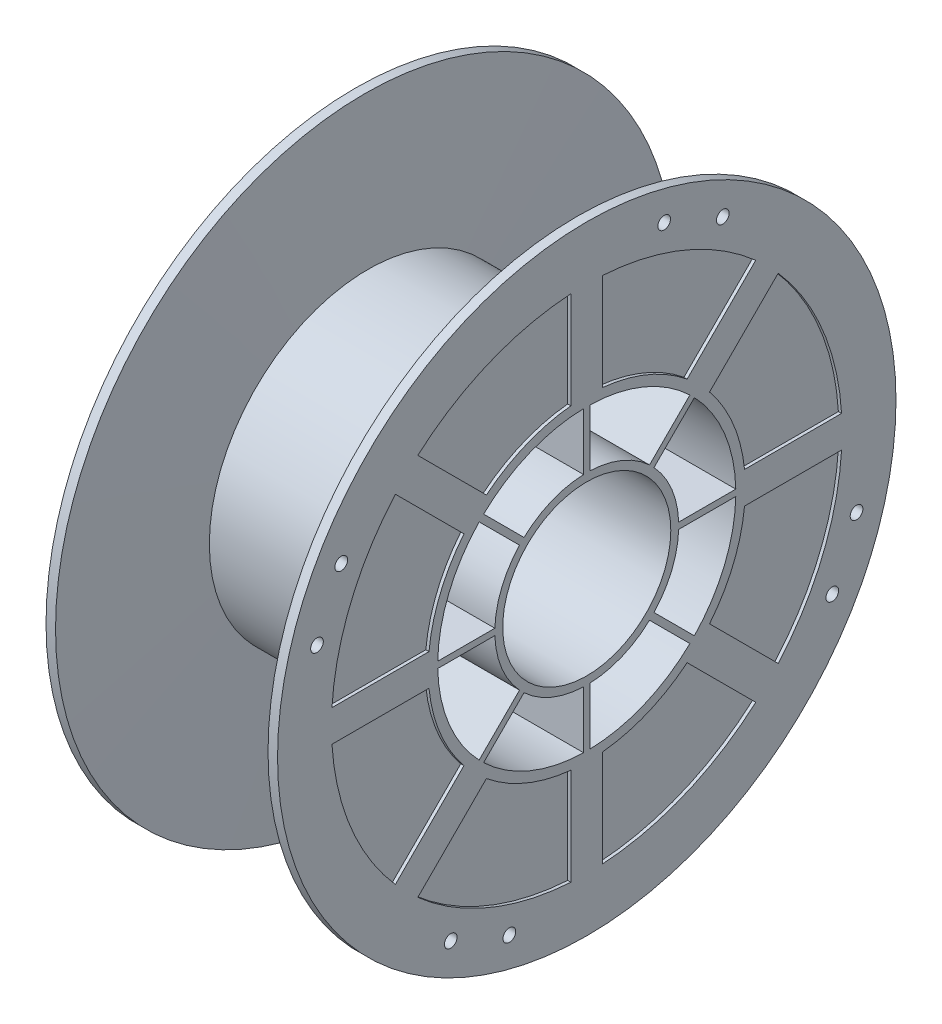
from build123d import *

# Parameters (mm, degrees)
SKETCH1_R                = 50
SKETCH1_R_2              = 26.5
BOSS_EXTRUDE1_DEPTH      = 6
BOSS_EXTRUDE2_DEPTH      = 36
BOSS_EXTRUDE2_DEPTH_BACK = 37
SKETCH2_R                = 50
SKETCH2_R_2              = 47
SKETCH2_R_3              = 29
SKETCH2_R_4              = 26.5
BOSS_EXTRUDE3_START      = -37
BOSS_EXTRUDE3_DEPTH      = 73
CIRPATTERN1_COUNT        = 8
BOSS_EXTRUDE4_START      = 1
BOSS_EXTRUDE4_DEPTH      = 1
BOSS_EXTRUDE5_DEPTH      = 1
CIRPATTERN2_COUNT        = 8
CUT_EXTRUDE1_REACH       = 158.018
SKETCH7_R                = 2
CIRPATTERN3_COUNT        = 4


with BuildPart() as part:
    # Sketch1 → Boss-Extrude1 (new body)
    with BuildSketch(Plane(origin=(0, 0, 0), x_dir=(0, 0, -1), z_dir=(1, 0, 0))):
        Circle(SKETCH1_R)
        Circle(SKETCH1_R_2, mode=Mode.SUBTRACT)
    extrude(amount=BOSS_EXTRUDE1_DEPTH)

    # Sketch2 → Boss-Extrude2 (add, two sides: drawn at the far end of the back side and taken through both)
    # profile 1 of 2: a face of its own
    with BuildSketch(Plane(origin=(0, 0, 0), x_dir=(0, 0, -1), z_dir=(1, 0, 0)).offset(-BOSS_EXTRUDE2_DEPTH_BACK)):
        Circle(SKETCH2_R)
        Circle(SKETCH2_R_2, mode=Mode.SUBTRACT)
    # profile 2 of 2: a face of its own
    with BuildSketch(Plane(origin=(0, 0, 0), x_dir=(0, 0, -1), z_dir=(1, 0, 0)).offset(-BOSS_EXTRUDE2_DEPTH_BACK)):
        Circle(SKETCH2_R_3)
        Circle(SKETCH2_R_4, mode=Mode.SUBTRACT)
    extrude(amount=BOSS_EXTRUDE2_DEPTH + BOSS_EXTRUDE2_DEPTH_BACK)

    # Sketch2<3> → Boss-Extrude3 (add)
    with BuildSketch(Plane(origin=(0, 0, 0), x_dir=(0, 0, -1), z_dir=(1, 0, 0)).offset(BOSS_EXTRUDE3_START)):
        with BuildLine():
            ThreePointArc((-1, 28.982753492), (0, 29), (1, 28.982753492))
            Line((1, 28.982753492), (1, 46.989360498))
            ThreePointArc((1, 46.989360498), (0, 47), (-1, 46.989360498))
            Line((-1, 46.989360498), (-1, 28.982753492))
        make_face()
    boss_extrude3 = extrude(amount=BOSS_EXTRUDE3_DEPTH)

    # CirPattern1: Boss-Extrude3 ×8 about axis
    cirpattern1_axis = Axis((6, 0, 0), (-1, 0, 0))
    for i in range(1, CIRPATTERN1_COUNT):
        add(boss_extrude3.rotate(cirpattern1_axis, i * 360 / CIRPATTERN1_COUNT))

    # Sketch4 → Revolve1 (revolve)
    with BuildSketch(Plane.XY):
        Polygon((36, 80.5), (36, 97.5), (33, 97.5), (32, 50), (35, 50), (35, 80.5), align=None)
        Polygon((-33, 50), (-36, 50), (-36, 67.5), (-37, 67.5), (-37, 97.5), (-34, 97.5), align=None)
    revolve(axis=Axis((0, 0, 0), (1, 0, 0)))

    # Sketch5 → Boss-Extrude4 (add)
    with BuildSketch(Plane.ZY.offset(36).offset(BOSS_EXTRUDE4_START)):
        with BuildLine():
            ThreePointArc((-5, 49.749371855), (0, 50), (5, 49.749371855))
            Line((5, 49.749371855), (5, 67.314560089))
            ThreePointArc((5, 67.314560089), (0, 67.5), (-5, 67.314560089))
            Line((-5, 67.314560089), (-5, 49.749371855))
        make_face()
    boss_extrude4 = extrude(amount=-BOSS_EXTRUDE4_DEPTH)

    # Sketch6 → Boss-Extrude5 (add)
    with BuildSketch(Plane(origin=(35, 0, 0), x_dir=(0, 0, -1), z_dir=(1, 0, 0))):
        with BuildLine():
            Line((5, 80.344570445), (5, 49.749371855))
            ThreePointArc((5, 49.749371855), (0, 50), (-5, 49.749371855))
            Line((-5, 49.749371855), (-5, 80.344570445))
            ThreePointArc((-5, 80.344570445), (0, 80.5), (5, 80.344570445))
        make_face()
    boss_extrude5 = extrude(amount=BOSS_EXTRUDE5_DEPTH)

    # CirPattern2: Boss-Extrude4, Boss-Extrude5 ×8 about axis
    cirpattern2_axis = Axis((6, 0, 0), (-1, 0, 0))
    add([boss_extrude4.rotate(cirpattern2_axis, i * 360 / CIRPATTERN2_COUNT) for i in range(1, CIRPATTERN2_COUNT)])
    add([boss_extrude5.rotate(cirpattern2_axis, i * 360 / CIRPATTERN2_COUNT) for i in range(1, CIRPATTERN2_COUNT)])

    # Sketch7 → Cut-Extrude1 (cut, up to next)
    with BuildSketch(Plane(origin=(36, 0, 0), x_dir=(0, 0, -1), z_dir=(1, 0, 0)), mode=Mode.PRIVATE) as cut_extrude1_sk1:
        with Locations((24.411788557, 85.066530313)):
            Circle(SKETCH7_R)
    cut_extrude1_tool1 = extrude(cut_extrude1_sk1.sketch, amount=-CUT_EXTRUDE1_REACH, mode=Mode.PRIVATE) & part.part
    # Sketch7 → Cut-Extrude1 (cut, up to next)
    with BuildSketch(Plane(origin=(36, 0, 0), x_dir=(0, 0, -1), z_dir=(1, 0, 0)), mode=Mode.PRIVATE) as cut_extrude1_sk2:
        with Locations((42.889379207, 77.412861666)):
            Circle(SKETCH7_R)
    cut_extrude1_tool2 = extrude(cut_extrude1_sk2.sketch, amount=-CUT_EXTRUDE1_REACH, mode=Mode.PRIVATE) & part.part
    cut_extrude1_1 = cut_extrude1_tool1.solids().sort_by_distance((36, 85.06653, -24.411789))[0]
    add(cut_extrude1_1, mode=Mode.SUBTRACT)
    cut_extrude1_2 = cut_extrude1_tool2.solids().sort_by_distance((36, 77.412862, -42.889379))[0]
    add(cut_extrude1_2, mode=Mode.SUBTRACT)
    cut_extrude1 = cut_extrude1_1 + cut_extrude1_2  # Cut-Extrude1 as one shape, for the pattern or mirror that repeats it

    # CirPattern3: Cut-Extrude1 ×4 about axis
    cirpattern3_axis = Axis((6, 0, 0), (-1, 0, 0))
    for i in range(1, CIRPATTERN3_COUNT):
        add(cut_extrude1.rotate(cirpattern3_axis, i * 360 / CIRPATTERN3_COUNT), mode=Mode.SUBTRACT)


solid = part.part
